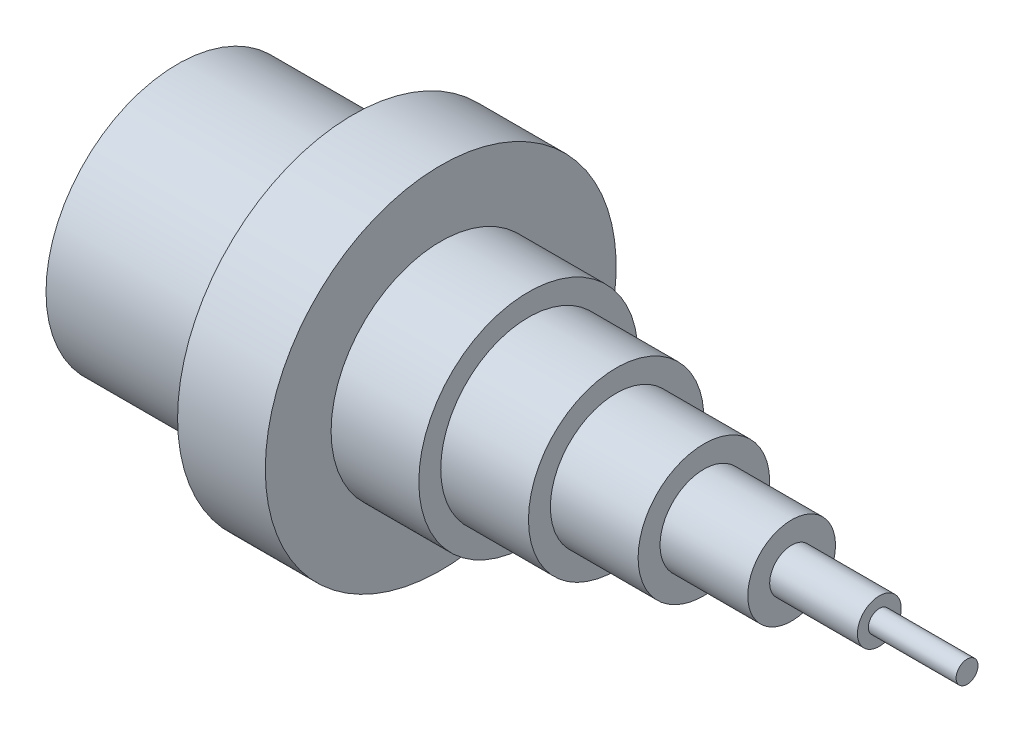
from build123d import *

# Parameters (mm, degrees)
SKETCH_1_W   = 40
SKETCH_1_H   = 10
SKETCH_1_W_2 = 20
SKETCH_1_H_2 = 40
SKETCH_1_H_3 = 2.5


with BuildPart() as part:
    # 草圖1 → 旋轉1 (revolve)
    with BuildSketch(Plane.XY, mode=Mode.PRIVATE) as revolve_1_sk:
        with Locations((-20, 25)):
            Rectangle(SKETCH_1_W, SKETCH_1_H)
        with Locations((10, 20)):
            Rectangle(SKETCH_1_W_2, SKETCH_1_H_2)
        Polygon((20, 25), (20, 0), (40, 0), (40, 20), (40, 25), align=None)
        Polygon((40, 20), (40, 0), (60, 0), (60, 15), (60, 20), align=None)
        Polygon((60, 15), (60, 0), (80, 0), (80, 10), (80, 15), align=None)
        Polygon((80, 10), (80, 0), (100, 0), (100, 5), (100, 10), align=None)
        Polygon((100, 5), (100, 0), (120, 0), (120, 2.5), (120, 5), align=None)
        with Locations((130, 1.25)):
            Rectangle(SKETCH_1_W_2, SKETCH_1_H_3)
    revolve(revolve_1_sk.sketch.rotate(Axis((0, 0, 0), (1, 0, 0)), 90), axis=Axis((0, 0, 0), (1, 0, 0)))


solid = part.part
